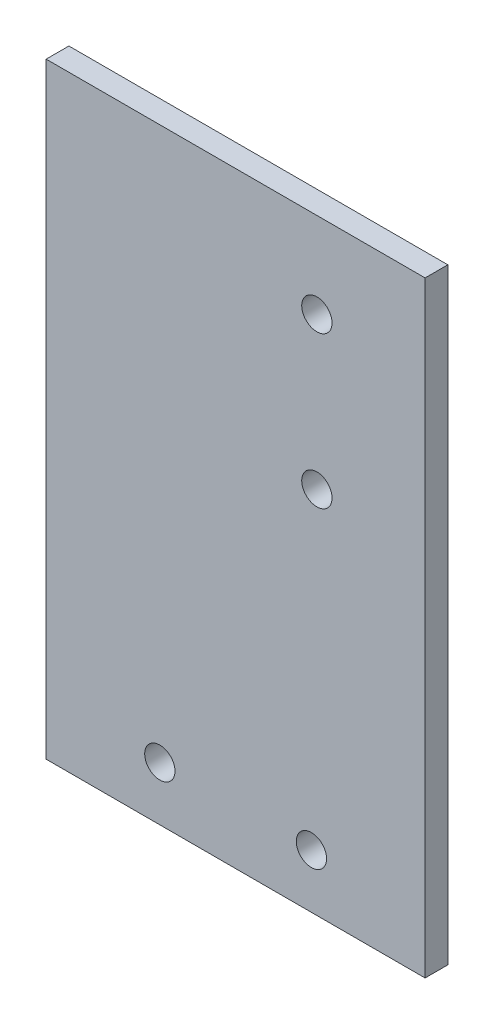
from build123d import *

# Parameters (mm, degrees)
SKETCH1_W           = 25
SKETCH1_H           = 40
SKETCH1_R           = 1
BOSS_EXTRUDE1_DEPTH = 1.5


with BuildPart() as part:
    # Sketch1 → Boss-Extrude1 (new body)
    with BuildSketch(Plane.XY):
        with Locations((-12.5, 20)):
            Rectangle(SKETCH1_W, SKETCH1_H)
        with Locations((-17.5, 3.560000002)):
            Circle(SKETCH1_R, mode=Mode.SUBTRACT)
        with Locations((-7.5, 3.560000002)):
            Circle(SKETCH1_R, mode=Mode.SUBTRACT)
        with Locations((-7.14, 34.350000002)):
            Circle(SKETCH1_R, mode=Mode.SUBTRACT)
        with Locations((-7.14, 24.350000002)):
            Circle(SKETCH1_R, mode=Mode.SUBTRACT)
    extrude(amount=BOSS_EXTRUDE1_DEPTH)


solid = part.part
